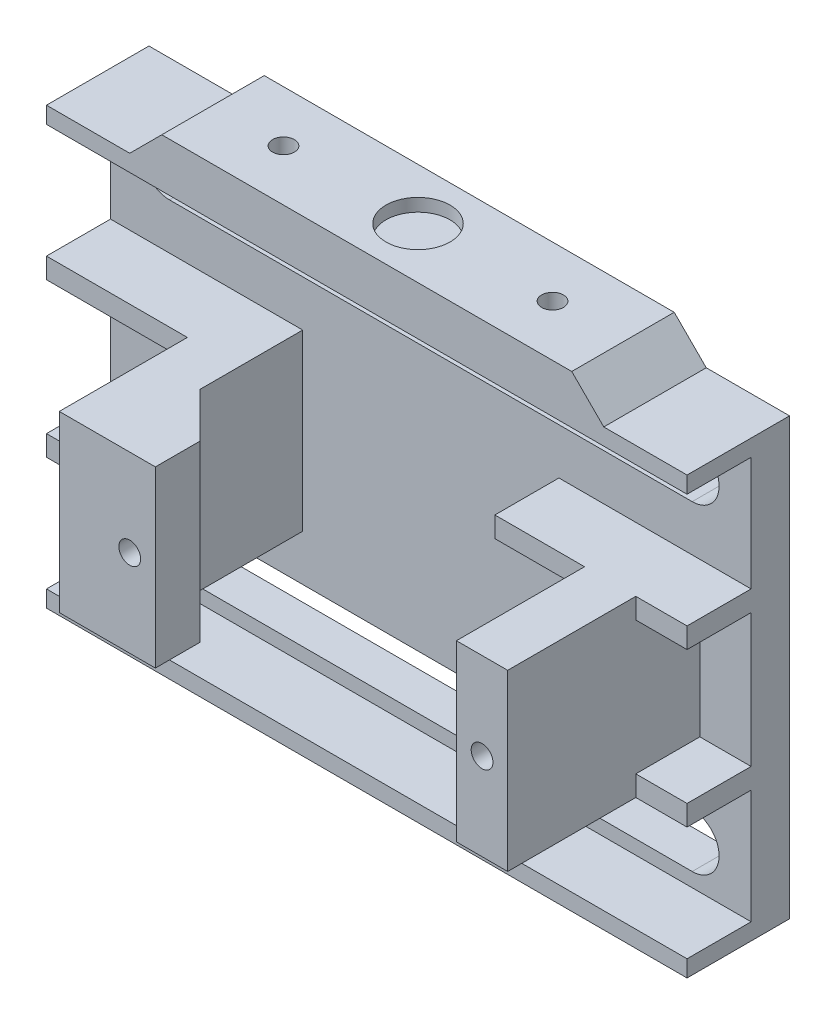
from build123d import *

# Parameters (mm, degrees)
SZKIC1_W                    = 50
SZKIC1_H                    = 34
DODANIE_WYCI_GNI_CIE1_DEPTH = 3
WYTNIJ_WYCI_GNI_CIE1_DEPTH  = 31.380915062
SZKIC2_W                    = 50
SZKIC2_H                    = 1.3
SZKIC2_W_2                  = 15
SZKIC2_H_2                  = 1.6
DODANIE_WYCI_GNI_CIE2_DEPTH = 5
DODANIE_WYCI_GNI_CIE5_DEPTH = 8
SZKIC9_R                    = 0.85
WYTNIJ_WYCI_GNI_CIE3_DEPTH  = 3
WYTNIJ_WYCI_GNI_CIE4_DEPTH  = 1
SZKIC5_W                    = 4
SZKIC5_H                    = 13.6
DODANIE_WYCI_GNI_CIE3_DEPTH = 15
DODANIE_WYCI_GNI_CIE4_START = -6.8
DODANIE_WYCI_GNI_CIE4_DEPTH = 13.6
SZKIC7_R                    = 0.85
WYTNIJ_WYCI_GNI_CIE2_DEPTH  = 8


with BuildPart() as part:
    # Szkic1 → Dodanie-wyciągnięcie1 (new body)
    with BuildSketch(Plane.XY):
        Rectangle(SZKIC1_W, SZKIC1_H)
    extrude(amount=DODANIE_WYCI_GNI_CIE1_DEPTH)

    # Szkic3 → Wytnij-wyciągnięcie1 (cut, through all)
    with BuildSketch(Plane.XY):
        with BuildLine():
            Line((-20.4, 14.6), (20.4, 14.6))
            ThreePointArc((20.4, 14.6), (22.5, 12.5), (20.4, 10.4))
            Line((20.4, 10.4), (-20.4, 10.4))
            ThreePointArc((-20.4, 10.4), (-22.5, 12.5), (-20.4, 14.6))
        make_face()
    wytnij_wyci_gni_cie1 = extrude(amount=WYTNIJ_WYCI_GNI_CIE1_DEPTH, mode=Mode.SUBTRACT)

    # Szkic2 → Dodanie-wyciągnięcie2 (add)
    with BuildSketch(Plane.XY.offset(3)):
        with Locations((0, 16.35)):
            Rectangle(SZKIC2_W, SZKIC2_H)
        with Locations((-17.5, 6)):
            Rectangle(SZKIC2_W_2, SZKIC2_H_2)
        with Locations((17.5, 6)):
            Rectangle(SZKIC2_W_2, SZKIC2_H_2)
    dodanie_wyci_gni_cie2 = extrude(amount=DODANIE_WYCI_GNI_CIE2_DEPTH)

    # Lustro1: Wytnij-wyciągnięcie1, Dodanie-wyciągnięcie2 across plane
    add(wytnij_wyci_gni_cie1.mirror(Plane.ZX), mode=Mode.SUBTRACT)
    add(dodanie_wyci_gni_cie2.mirror(Plane.ZX))

    # Szkic8 → Dodanie-wyciągnięcie5 (add)
    with BuildSketch(Plane(origin=(0, 0, 0), x_dir=(-1, 0, 0), z_dir=(0, 0, -1))):
        Polygon((-18.5, 17), (-16, 19.5), (16, 19.5), (18.5, 17), align=None)
    extrude(amount=-DODANIE_WYCI_GNI_CIE5_DEPTH)

    # Szkic9 → Wytnij-wyciągnięcie3 (cut)
    with BuildSketch(Plane(origin=(0, 19.5, 0), x_dir=(1, 0, 0), z_dir=(0, 1, 0))):
        with Locations(Location((-10.5, -4, 0), (0, 0, 270))):
            Circle(SZKIC9_R)
        with Locations(Location((10.5, -4, 0), (0, 0, 270))):
            Circle(SZKIC9_R)
    extrude(amount=-WYTNIJ_WYCI_GNI_CIE3_DEPTH, mode=Mode.SUBTRACT)

    # Szkic9<3> → Wytnij-wyciągnięcie4 (cut)
    with BuildSketch(Plane(origin=(0, 19.5, 0), x_dir=(1, 0, 0), z_dir=(0, 1, 0))):
        with BuildLine():
            ThreePointArc((2.5, -4), (1.767766953, -2.232233047), (0, -1.5))
            Line((0, -1.5), (0, -6.5))
            ThreePointArc((0, -6.5), (1.767766953, -5.767766953), (2.5, -4))
        make_face()
        with BuildLine():
            Line((0, -6.5), (0, -1.5))
            ThreePointArc((0, -1.5), (-2.5, -4), (0, -6.5))
        make_face()
    extrude(amount=-WYTNIJ_WYCI_GNI_CIE4_DEPTH, mode=Mode.SUBTRACT)

    # Szkic5 → Dodanie-wyciągnięcie3 (add)
    with BuildSketch(Plane.XY.offset(3)):
        with Locations((19, 0)):
            Rectangle(SZKIC5_W, SZKIC5_H)
        with Locations((-12, 0)):
            Rectangle(SZKIC5_W, SZKIC5_H)
    extrude(amount=DODANIE_WYCI_GNI_CIE3_DEPTH)

    # Szkic6 → Dodanie-wyciągnięcie4 (add)
    with BuildSketch(Plane(origin=(0, 0, 0), x_dir=(1, 0, 0), z_dir=(0, 1, 0)).offset(DODANIE_WYCI_GNI_CIE4_START)):
        Polygon((-10, -18), (-6.5, -18), (-6.5, -14.5), (-10, -11), align=None)
    extrude(amount=DODANIE_WYCI_GNI_CIE4_DEPTH)

    # Szkic7 → Wytnij-wyciągnięcie2 (cut)
    with BuildSketch(Plane.XY.offset(18)):
        with Locations((-8.5, 0)):
            Circle(SZKIC7_R)
        with Locations((19, 0)):
            Circle(SZKIC7_R)
    extrude(amount=-WYTNIJ_WYCI_GNI_CIE2_DEPTH, mode=Mode.SUBTRACT)


solid = part.part
